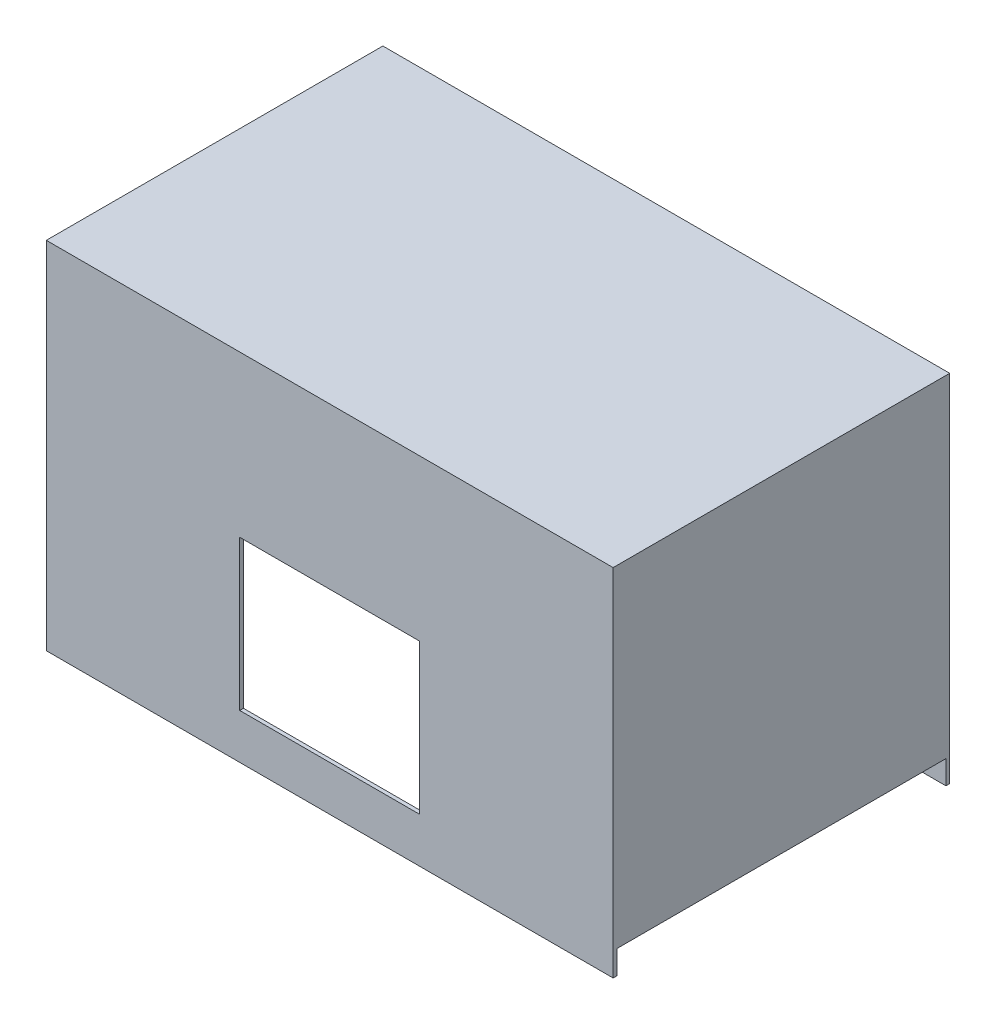
from build123d import *

# Parameters (mm, degrees)
ESQUISSE1_W             = 960
ESQUISSE1_H             = 601.98
BOSS_EXTRU_1_DEPTH      = 285
ESQUISSE4_W             = 947.3
ESQUISSE4_H             = 557.3
ENL_V_MAT_EXTRU_7_DEPTH = 595.63
ESQUISSE5_W             = 557.3
ESQUISSE5_H             = 40
ENL_V_MAT_EXTRU_8_DEPTH = 1046.667241574
ESQUISSE6_W             = 304.8
ESQUISSE6_H             = 254
ENL_V_MAT_EXTRU_9_DEPTH = 25.4


with BuildPart() as part:
    # Esquisse1 → Boss.-Extru.1 (new, symmetric)
    with BuildSketch(Plane.XY):
        Rectangle(ESQUISSE1_W, ESQUISSE1_H)
    extrude(amount=BOSS_EXTRU_1_DEPTH, both=True)

    # Esquisse4 → Enlèv. mat.-Extru.7 (cut)
    with BuildSketch(Plane.XZ.offset(300.99)):
        Rectangle(ESQUISSE4_W, ESQUISSE4_H)
    extrude(amount=-ENL_V_MAT_EXTRU_7_DEPTH, mode=Mode.SUBTRACT)

    # Esquisse5 → Enlèv. mat.-Extru.8 (cut, through all)
    with BuildSketch(Plane(origin=(480, 0, 0), x_dir=(0, 0, -1), z_dir=(1, 0, 0))):
        with Locations((0, -280.99)):
            Rectangle(ESQUISSE5_W, ESQUISSE5_H)
    extrude(amount=-ENL_V_MAT_EXTRU_8_DEPTH, mode=Mode.SUBTRACT)

    # Esquisse6 → Enlèv. mat.-Extru.9 (cut)
    with BuildSketch(Plane.XY.offset(285)):
        with Locations((0, -97.79)):
            Rectangle(ESQUISSE6_W, ESQUISSE6_H)
    extrude(amount=-ENL_V_MAT_EXTRU_9_DEPTH, mode=Mode.SUBTRACT)


solid = part.part
